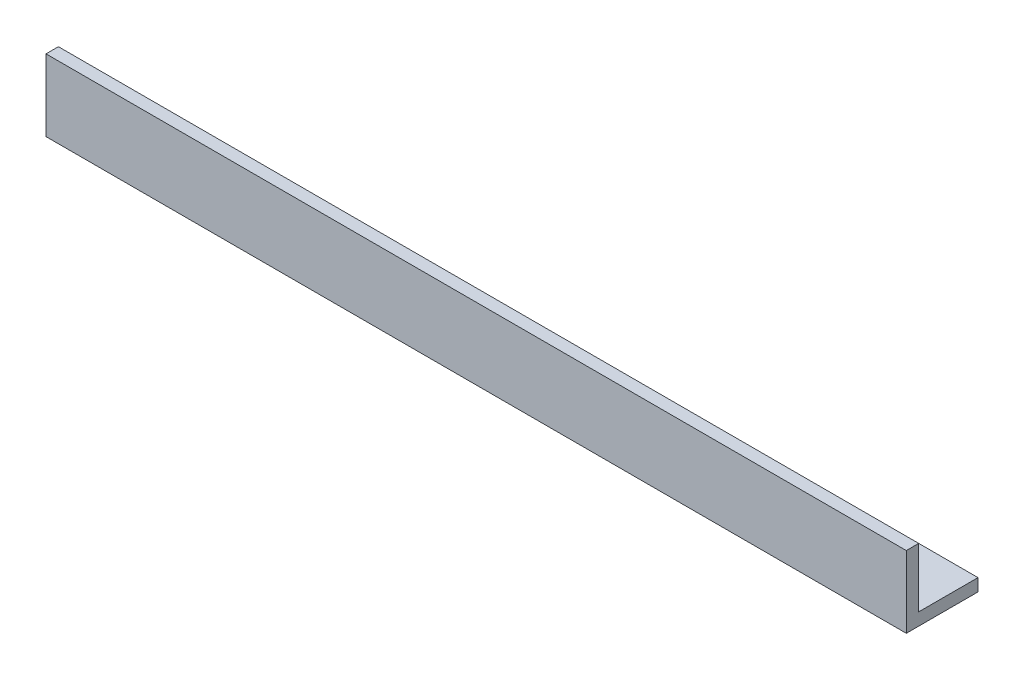
from build123d import *

# Parameters (mm, degrees)
BOSS_EXTRUDE1_DEPTH = 240


with BuildPart() as part:
    # Sketch1 → Boss-Extrude1 (new body)
    with BuildSketch(Plane(origin=(0, 0, 0), x_dir=(0, 0, -1), z_dir=(1, 0, 0))):
        Polygon((0, 0), (20, 0), (20, 3.461178467), (3.461178467, 3.461178467), (3.461178467, 20), (0, 20), align=None)
    extrude(amount=BOSS_EXTRUDE1_DEPTH)


solid = part.part
